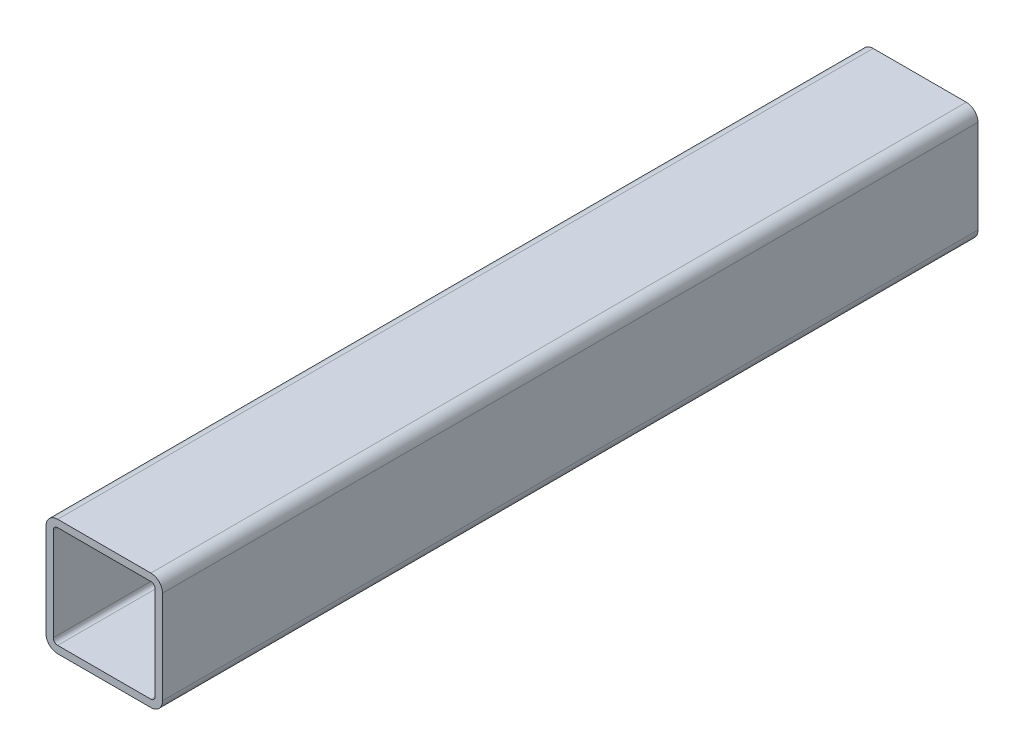
from build123d import *

# Parameters (mm, degrees)
DODANIE_WYCI_GNI_CIE1_DEPTH = 560


with BuildPart() as part:
    # Szkic1 → Dodanie-wyciągnięcie1 (new body)
    with BuildSketch(Plane.XY):
        with BuildLine():
            Line((143, 0), (207, 0))
            ThreePointArc((207, 0), (212.656854249, 2.343145751), (215, 8))
            Line((215, 8), (215, 72))
            ThreePointArc((215, 72), (212.656854249, 77.656854249), (207, 80))
            Line((207, 80), (143, 80))
            ThreePointArc((143, 80), (137.343145751, 77.656854249), (135, 72))
            Line((135, 72), (135, 8))
            ThreePointArc((135, 8), (137.343145751, 2.343145751), (143, 0))
        make_face()
        with BuildLine():
            Line((140, 8), (140, 72))
            ThreePointArc((140, 72), (140.878679656, 74.121320344), (143, 75))
            Line((143, 75), (207, 75))
            ThreePointArc((207, 75), (209.121320344, 74.121320344), (210, 72))
            Line((210, 72), (210, 8))
            ThreePointArc((210, 8), (209.121320344, 5.878679656), (207, 5))
            Line((207, 5), (143, 5))
            ThreePointArc((143, 5), (140.878679656, 5.878679656), (140, 8))
        make_face(mode=Mode.SUBTRACT)
    extrude(amount=DODANIE_WYCI_GNI_CIE1_DEPTH)


solid = part.part
